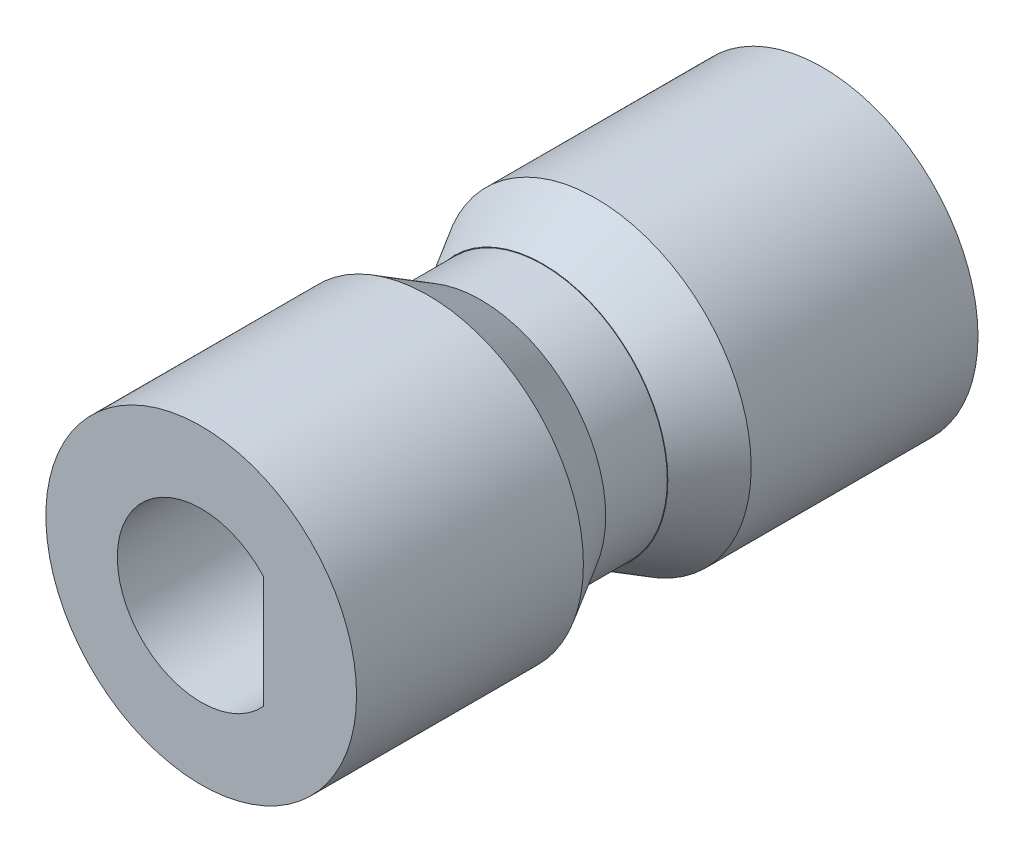
from build123d import *
from OCP.BRepFilletAPI import BRepFilletAPI_MakeChamfer

# Parameters (mm, degrees)
SKETCH_3_R          = 5
EXTRUDE_2_DEPTH     = 9
SKETCH_4_R          = 4
EXTRUDE_3_DEPTH     = 2
SKETCH_5_R          = 5
EXTRUDE_4_DEPTH     = 9
CUT_EXTRUDE_5_REACH = 23.213
CHAMFER_2_SIZE      = 1.7
CHAMFER_2_SIZE2     = 0.981495458


with BuildPart() as part:
    # Эскиз3 → Вытянуть2 (new body)
    with BuildSketch(Plane.XY):
        Circle(SKETCH_3_R)
    extrude(amount=EXTRUDE_2_DEPTH)

    # Эскиз4 → Вытянуть3 (add)
    with BuildSketch(Plane.XY.offset(9)):
        Circle(SKETCH_4_R)
    extrude(amount=EXTRUDE_3_DEPTH)

    # Эскиз5 → Вытянуть4 (add)
    with BuildSketch(Plane.XY.offset(11)):
        Circle(SKETCH_5_R)
    extrude(amount=EXTRUDE_4_DEPTH)

    # Эскиз1 → Вытянуть5 (cut, up to next)
    with BuildSketch(Plane.XY, mode=Mode.PRIVATE) as cut_extrude_5_sk1:
        with BuildLine():
            Line((2, 1.813835715), (2, -1.813835715))
            ThreePointArc((2, -1.813835715), (-2.7, 0), (2, 1.813835715))
        make_face()
    cut_extrude_5_tool1 = extrude(cut_extrude_5_sk1.sketch, amount=CUT_EXTRUDE_5_REACH, mode=Mode.PRIVATE) & part.part
    add(cut_extrude_5_tool1.solids().sort_by_distance((-0.188014, 0, 0))[0], mode=Mode.SUBTRACT)

    # Фаска2: one chamfer whose edges measure the first distance from different faces: ONE call of the kernel's chamfer builder (chamfer() names one face for all edges)
    chamfer_2_edges_1 = [part.edges().sort_by_distance(p)[0] for p in [
        (-5, 0, 9),
    ]]
    chamfer_2_side_1 = [part.faces().sort_by_distance(p)[0] for p in [
        (-5, 0, 4.5),
    ]]
    chamfer_2_edges_2 = [part.edges().sort_by_distance(p)[0] for p in [
        (-5, 0, 11),
    ]]
    chamfer_2_side_2 = [part.faces().sort_by_distance(p)[0] for p in [
        (-5, 0, 15.5),
    ]]
    chamfer_2 = BRepFilletAPI_MakeChamfer(part.part.solid().wrapped)
    for e in chamfer_2_edges_1:
        chamfer_2.Add(CHAMFER_2_SIZE, CHAMFER_2_SIZE2, e.wrapped, chamfer_2_side_1[0].wrapped)  # the first distance lies on this face
    for e in chamfer_2_edges_2:
        chamfer_2.Add(CHAMFER_2_SIZE, CHAMFER_2_SIZE2, e.wrapped, chamfer_2_side_2[0].wrapped)  # the first distance lies on this face
    add(Compound.cast(chamfer_2.Shape()), mode=Mode.REPLACE)


solid = part.part
